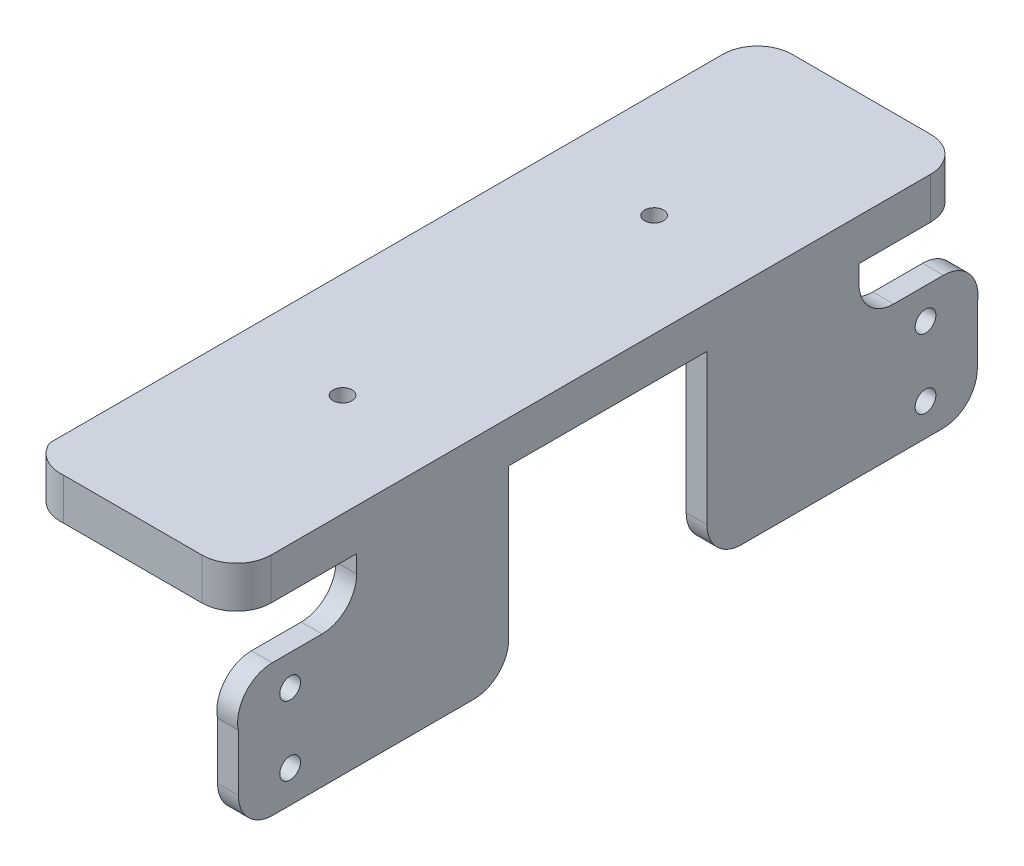
from build123d import *

# Parameters (mm, degrees)
SKETCH1_R           = 1.364040511
BOSS_EXTRUDE1_DEPTH = 6
SKETCH4_R           = 1.5
BOSS_EXTRUDE5_DEPTH = 3
SKETCH3_R           = 1.5
BOSS_EXTRUDE6_DEPTH = 3


with BuildPart() as part:
    # Sketch1 → Boss-Extrude1 (new body)
    # profile 1 of 2: a face of its own
    with BuildSketch(Plane(origin=(0, 0, 0), x_dir=(1, 0, 0), z_dir=(0, 1, 0))):
        with BuildLine():
            Line((-10, 51.603803494), (10, 51.603803494))
            ThreePointArc((10, 51.603803494), (13.535533906, 50.1393374), (15, 46.603803494))
            Line((15, 46.603803494), (15, -48.613608646))
            ThreePointArc((15, -48.613608646), (13.535533906, -52.149142552), (10, -53.613608646))
            Line((10, -53.613608646), (-10, -53.613608646))
            ThreePointArc((-10, -53.613608646), (-12.980498394, -52.921967883), (-15, -50.623413797))
            Line((-15, -50.623413797), (-15, 46.603803494))
            ThreePointArc((-15, 46.603803494), (-13.535533906, 50.1393374), (-10, 51.603803494))
        make_face()
        with BuildLine():
            add(Edge.make_bspline(
                [(7.103394801, 36.603803494), (7.103428618, 37.026608701), (7.023458613, 37.897786813), (6.652030077, 39.189720654), (6.008373502, 40.43217773), (5.107818335, 41.540791746), (3.999168184, 42.441376612), (2.756787758, 43.085002424), (1.464707811, 43.456485636), (0.170821493, 43.575183606), (-1.123160032, 43.456472732), (-2.41511602, 43.085023092), (-3.657566922, 42.44137221), (-4.766182894, 41.540815951), (-5.666766236, 40.432164393), (-6.310396109, 39.189790584), (-6.68186499, 37.897686237), (-6.761809336, 37.026687813), (-6.761782928, 36.603803494)],
                knots=[-37.859638657, -37.859638657, -37.859638657, -37.859638657, -35.654498695, -33.316868236, -30.881728236, -28.394728993, -25.90772975, -23.472589749, -21.13495929, -18.929819328, -16.724679367, -14.387048908, -11.951908907, -9.464909664, -6.977910421, -4.542770421, -2.205139962, 0, 0, 0, 0], degree=3))
            Line((-6.761782928, 36.603803494), (-6.761782928, -1.004902576))
            Line((-6.761782928, -1.004902576), (-6.761782928, -38.613608646))
            add(Edge.make_bspline(
                [(-6.761782928, -38.613608646), (-6.761816745, -39.036413853), (-6.68184674, -39.907591962), (-6.310418207, -41.199525799), (-5.666761633, -42.441982875), (-4.766206468, -43.550596892), (-3.657556317, -44.451181759), (-2.415175894, -45.094807572), (-1.123095943, -45.466290787), (0.170790381, -45.584988758), (1.464771908, -45.466277883), (2.756727907, -45.094828239), (3.999178808, -44.451177353), (5.107794779, -43.55062109), (6.008378118, -42.441969531), (6.652007988, -41.199595719), (7.023476864, -39.907491379), (7.103421209, -39.036492961), (7.103394801, -38.613608646)],
                knots=[-37.859638657, -37.859638657, -37.859638657, -37.859638657, -35.654498695, -33.316868236, -30.881728236, -28.394728993, -25.90772975, -23.472589749, -21.13495929, -18.929819328, -16.724679367, -14.387048908, -11.951908907, -9.464909664, -6.977910421, -4.542770421, -2.205139962, 0, 0, 0, 0], degree=3))
            Line((7.103394801, -38.613608646), (7.103394801, 36.603803494))
        make_face(mode=Mode.SUBTRACT)
    # profile 2 of 2: a face of its own
    with BuildSketch(Plane(origin=(0, 0, 0), x_dir=(1, 0, 0), z_dir=(0, 1, 0))):
        with BuildLine():
            Line((7.103394801, -38.613608646), (7.103394801, 36.603803494))
            add(Edge.make_bspline(
                [(7.103394801, 36.603803494), (7.103428618, 37.026608701), (7.023458613, 37.897786813), (6.652030077, 39.189720654), (6.008373502, 40.43217773), (5.107818335, 41.540791746), (3.999168184, 42.441376612), (2.756787758, 43.085002424), (1.464707811, 43.456485636), (0.170821493, 43.575183606), (-1.123160032, 43.456472732), (-2.41511602, 43.085023092), (-3.657566922, 42.44137221), (-4.766182894, 41.540815951), (-5.666766236, 40.432164393), (-6.310396109, 39.189790584), (-6.68186499, 37.897686237), (-6.761809336, 37.026687813), (-6.761782928, 36.603803494)],
                knots=[-37.859638657, -37.859638657, -37.859638657, -37.859638657, -35.654498695, -33.316868236, -30.881728236, -28.394728993, -25.90772975, -23.472589749, -21.13495929, -18.929819328, -16.724679367, -14.387048908, -11.951908907, -9.464909664, -6.977910421, -4.542770421, -2.205139962, 0, 0, 0, 0], degree=3))
            Line((-6.761782928, 36.603803494), (-6.761782928, -1.004902576))
            Line((-6.761782928, -1.004902576), (-6.761782928, -38.613608646))
            add(Edge.make_bspline(
                [(-6.761782928, -38.613608646), (-6.761816745, -39.036413853), (-6.68184674, -39.907591962), (-6.310418207, -41.199525799), (-5.666761633, -42.441982875), (-4.766206468, -43.550596892), (-3.657556317, -44.451181759), (-2.415175894, -45.094807572), (-1.123095943, -45.466290787), (0.170790381, -45.584988758), (1.464771908, -45.466277883), (2.756727907, -45.094828239), (3.999178808, -44.451177353), (5.107794779, -43.55062109), (6.008378118, -42.441969531), (6.652007988, -41.199595719), (7.023476864, -39.907491379), (7.103421209, -39.036492961), (7.103394801, -38.613608646)],
                knots=[-37.859638657, -37.859638657, -37.859638657, -37.859638657, -35.654498695, -33.316868236, -30.881728236, -28.394728993, -25.90772975, -23.472589749, -21.13495929, -18.929819328, -16.724679367, -14.387048908, -11.951908907, -9.464909664, -6.977910421, -4.542770421, -2.205139962, 0, 0, 0, 0], degree=3))
        make_face()
        with Locations(Location((0.18553554, 21.494758613, 0), (0, 0, 270))):
            Circle(SKETCH1_R, mode=Mode.SUBTRACT)
        with Locations(Location((0.18553554, -23.489418781, 0), (0, 0, 270))):
            Circle(SKETCH1_R, mode=Mode.SUBTRACT)
    extrude(amount=BOSS_EXTRUDE1_DEPTH)

    # Sketch4 → Boss-Extrude5 (add)
    with BuildSketch(Plane(origin=(15, 0, 0), x_dir=(0, 0, -1), z_dir=(1, 0, 0))):
        with BuildLine():
            Line((-14.308611252, 0), (-36.266917034, 0))
            Line((-36.266917034, 0), (-36.266917034, -2.552121764))
            ThreePointArc((-36.266917034, -2.552121764), (-37.731383128, -6.08765567), (-41.266917034, -7.552121764))
            Line((-41.266917034, -7.552121764), (-48.449167737, -7.552121764))
            ThreePointArc((-48.449167737, -7.552121764), (-52.322151083, -9.389844104), (-53.348147222, -13.552121764))
            Line((-53.348147222, -13.552121764), (-53.348147222, -21.671405468))
            ThreePointArc((-53.348147222, -21.671405468), (-51.883681128, -25.206939374), (-48.348147222, -26.671405468))
            Line((-48.348147222, -26.671405468), (-19.308611252, -26.671405468))
            ThreePointArc((-19.308611252, -26.671405468), (-15.773077347, -25.206939374), (-14.308611252, -21.671405468))
            Line((-14.308611252, -21.671405468), (-14.308611252, 0))
        make_face()
        with Locations((-45.868510931, -22.002234766)):
            Circle(SKETCH4_R, mode=Mode.SUBTRACT)
        with Locations((-45.868510931, -12.002234766)):
            Circle(SKETCH4_R, mode=Mode.SUBTRACT)
    extrude(amount=-BOSS_EXTRUDE5_DEPTH)

    # Sketch3 → Boss-Extrude6 (add)
    with BuildSketch(Plane(origin=(15, 0, 0), x_dir=(0, 0, -1), z_dir=(1, 0, 0))):
        with BuildLine():
            Line((36.266917034, -2.552121764), (36.266917034, 0))
            Line((36.266917034, 0), (14.308611252, 0))
            Line((14.308611252, 0), (14.308611252, -21.671405468))
            ThreePointArc((14.308611252, -21.671405468), (15.773077347, -25.206939374), (19.308611252, -26.671405468))
            Line((19.308611252, -26.671405468), (48.348147222, -26.671405468))
            ThreePointArc((48.348147222, -26.671405468), (51.883681128, -25.206939374), (53.348147222, -21.671405468))
            Line((53.348147222, -21.671405468), (53.348147222, -13.552121764))
            ThreePointArc((53.348147222, -13.552121764), (52.322151083, -9.389844104), (48.449167737, -7.552121764))
            Line((48.449167737, -7.552121764), (41.266917034, -7.552121764))
            ThreePointArc((41.266917034, -7.552121764), (37.731383128, -6.08765567), (36.266917034, -2.552121764))
        make_face()
        with Locations((45.868510931, -22.002234766)):
            Circle(SKETCH3_R, mode=Mode.SUBTRACT)
        with Locations((45.868510931, -12.002234766)):
            Circle(SKETCH3_R, mode=Mode.SUBTRACT)
    extrude(amount=-BOSS_EXTRUDE6_DEPTH)


solid = part.part
